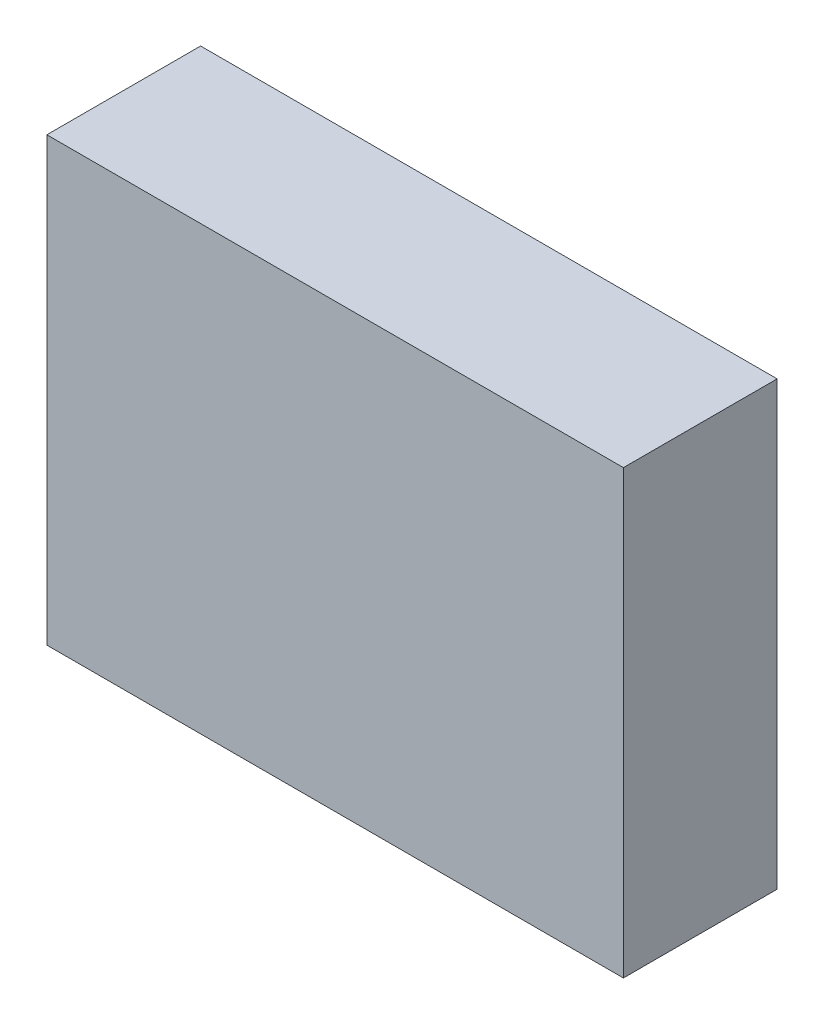
from build123d import *

# Parameters (mm, degrees)
SKETCH_1_W      = 300
SKETCH_1_H      = 230
EXTRUDE_1_DEPTH = 80


with BuildPart() as part:
    # 草图1 → 凸台-拉伸1 (new body)
    with BuildSketch(Plane.XY):
        with Locations((150, 115)):
            Rectangle(SKETCH_1_W, SKETCH_1_H)
    extrude(amount=EXTRUDE_1_DEPTH)


solid = part.part
